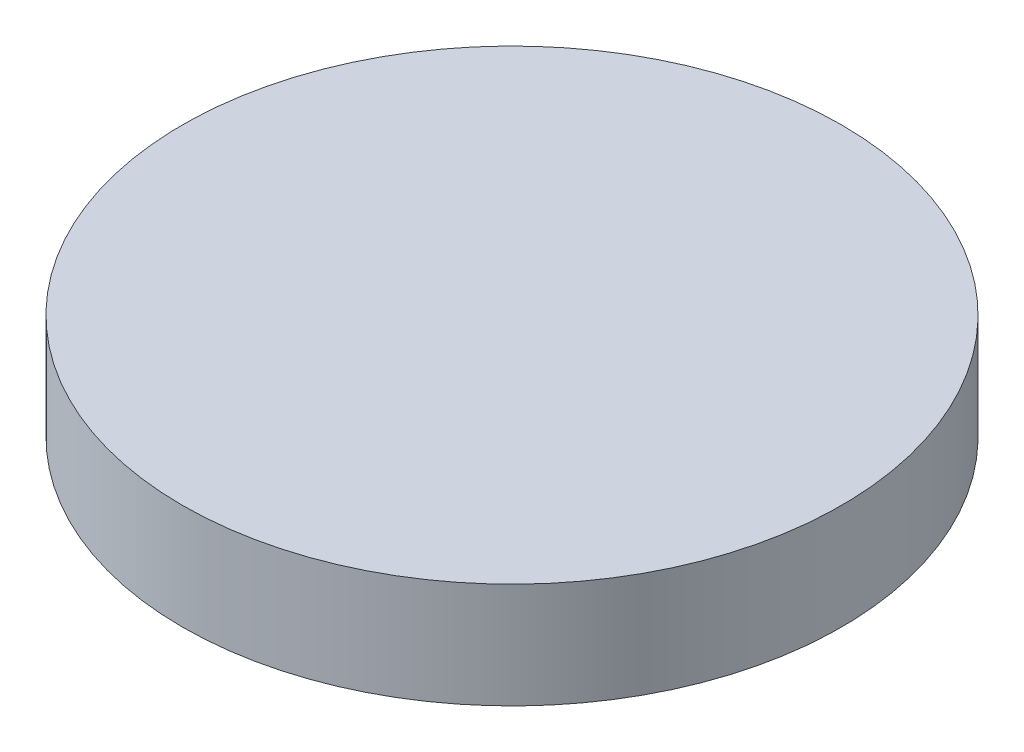
from build123d import *

# Parameters (mm, degrees)
SKETCH1_R           = 25.4
BOSS_EXTRUDE1_DEPTH = 8.128


with BuildPart() as part:
    # Sketch1 → Boss-Extrude1 (new body)
    with BuildSketch(Plane(origin=(0, 0, 0), x_dir=(1, 0, 0), z_dir=(0, 1, 0))):
        with Locations(Location((0, 0, 0), (0, 0, 270))):
            Circle(SKETCH1_R)
    extrude(amount=BOSS_EXTRUDE1_DEPTH)


solid = part.part
